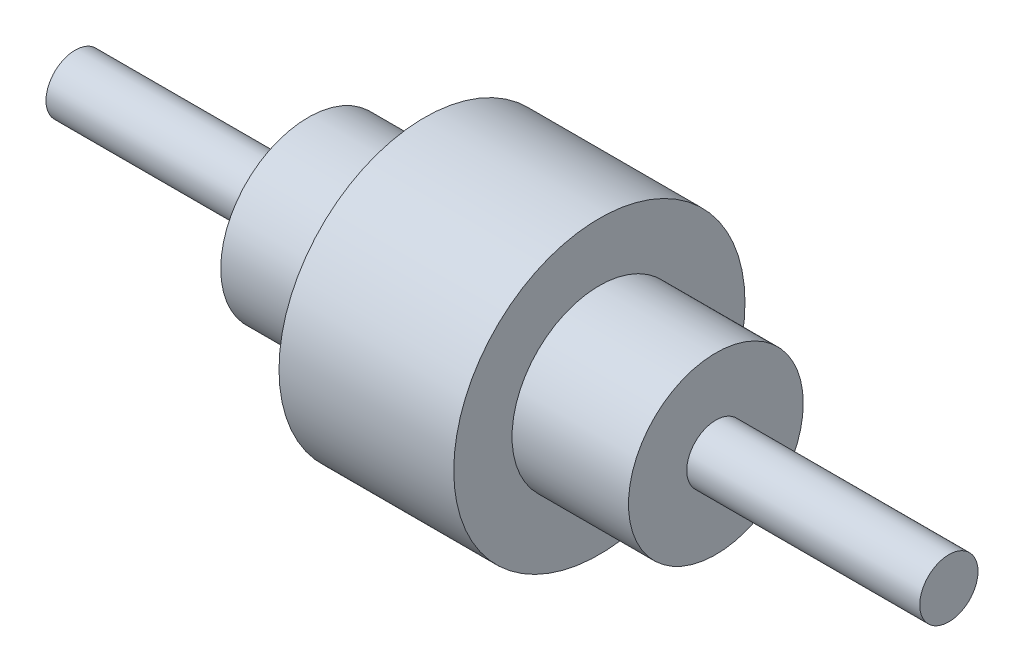
from build123d import *

# Parameters (mm, degrees)
SKETCH3_R           = 50
BOSS_EXTRUDE1_DEPTH = 150
SKETCH4_R           = 50
SKETCH4_R_2         = 30
CUT_EXTRUDE1_DEPTH  = 120
SKETCH5_R           = 30
SKETCH5_R_2         = 10
CUT_EXTRUDE2_DEPTH  = 80
CUT_EXTRUDE3_START  = -120
SKETCH6_R           = 50
SKETCH6_R_2         = 30
CUT_EXTRUDE3_DEPTH  = 120
CUT_EXTRUDE4_START  = -80
SKETCH7_R           = 30
SKETCH7_R_2         = 10
CUT_EXTRUDE4_DEPTH  = 80


with BuildPart() as part:
    # Sketch3 → Boss-Extrude1 (new, symmetric)
    with BuildSketch(Plane(origin=(0, 0, 0), x_dir=(0, 0, -1), z_dir=(1, 0, 0))):
        Circle(SKETCH3_R)
    extrude(amount=BOSS_EXTRUDE1_DEPTH, both=True)

    # Sketch4 → Cut-Extrude1 (cut)
    with BuildSketch(Plane(origin=(150, 0, 0), x_dir=(0, 0, -1), z_dir=(1, 0, 0))):
        Circle(SKETCH4_R)
        Circle(SKETCH4_R_2, mode=Mode.SUBTRACT)
    extrude(amount=-CUT_EXTRUDE1_DEPTH, mode=Mode.SUBTRACT)

    # Sketch5 → Cut-Extrude2 (cut)
    with BuildSketch(Plane(origin=(150, 0, 0), x_dir=(0, 0, -1), z_dir=(1, 0, 0))):
        Circle(SKETCH5_R)
        Circle(SKETCH5_R_2, mode=Mode.SUBTRACT)
    extrude(amount=-CUT_EXTRUDE2_DEPTH, mode=Mode.SUBTRACT)

    # Sketch6 → Cut-Extrude3 (cut)
    with BuildSketch(Plane.ZY.offset(150).offset(CUT_EXTRUDE3_START)):
        Circle(SKETCH6_R)
        with Locations(Location((0, 0, 0), (0, 0, 180))):
            Circle(SKETCH6_R_2, mode=Mode.SUBTRACT)
    extrude(amount=CUT_EXTRUDE3_DEPTH, mode=Mode.SUBTRACT)

    # Sketch7 → Cut-Extrude4 (cut)
    with BuildSketch(Plane.ZY.offset(150).offset(CUT_EXTRUDE4_START)):
        Circle(SKETCH7_R)
        with Locations(Location((0, 0, 0), (0, 0, 180))):
            Circle(SKETCH7_R_2, mode=Mode.SUBTRACT)
    extrude(amount=CUT_EXTRUDE4_DEPTH, mode=Mode.SUBTRACT)


solid = part.part
